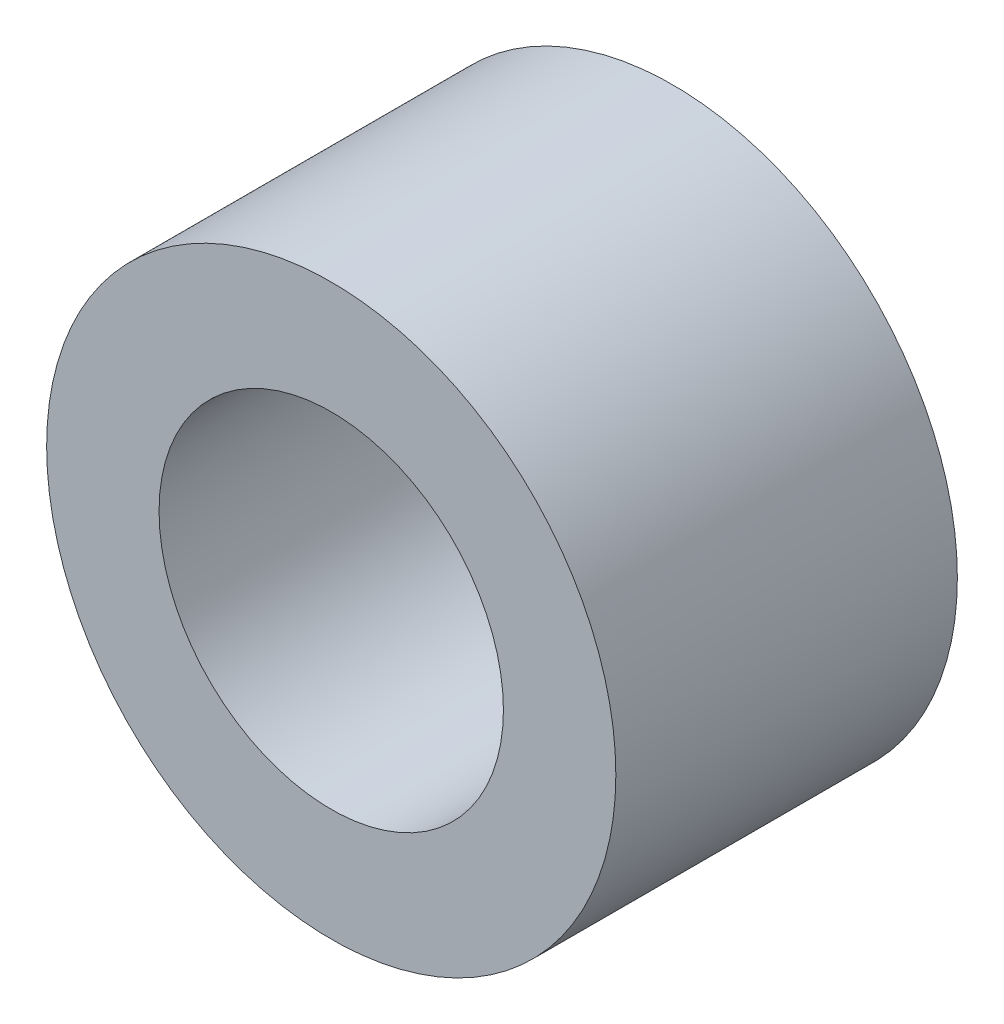
from build123d import *

# Parameters (mm, degrees)
SKETCH1_R           = 5
BOSS_EXTRUDE1_DEPTH = 6
SKETCH2_R           = 3.025
CUT_EXTRUDE1_DEPTH  = 5.5


with BuildPart() as part:
    # Sketch1 → Boss-Extrude1 (new body)
    with BuildSketch(Plane.XY):
        Circle(SKETCH1_R)
    extrude(amount=BOSS_EXTRUDE1_DEPTH)

    # Sketch2 → Cut-Extrude1 (cut)
    with BuildSketch(Plane.XY.offset(6)):
        Circle(SKETCH2_R)
    extrude(amount=-CUT_EXTRUDE1_DEPTH, mode=Mode.SUBTRACT)


solid = part.part
